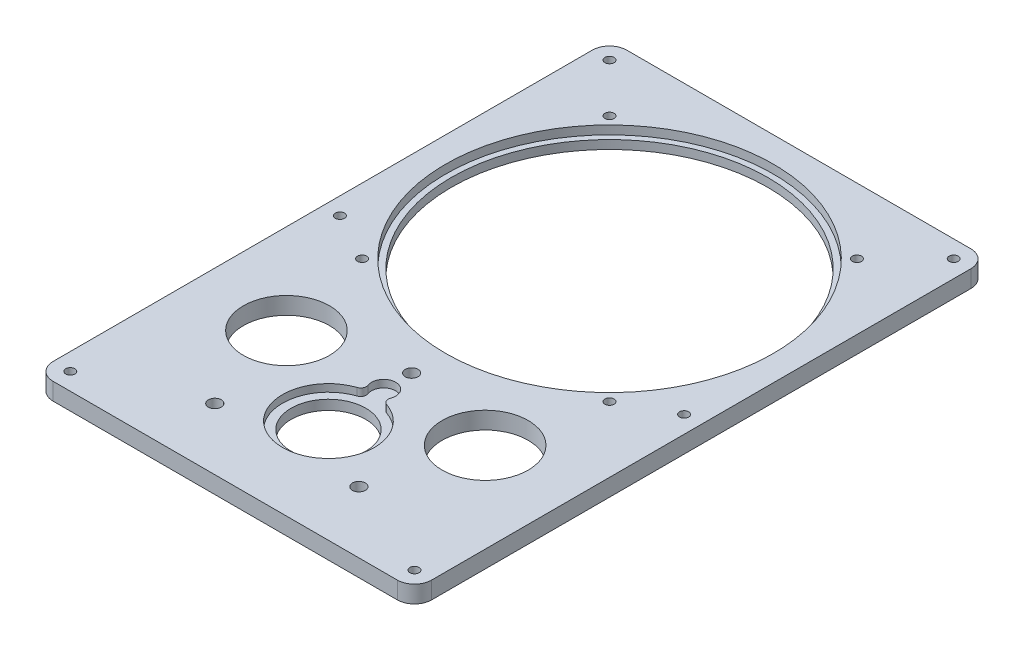
from build123d import *

# Parameters (mm, degrees)
SKETCH_2_W          = 132
SKETCH_2_H          = 200
EXTRUDE_1_DEPTH     = 6
SKETCH_3_R          = 57.15
CUT_EXTRUDE_1_DEPTH = 6
EXTRUDE_START       = 3
SKETCH_6_R          = 57.15
SKETCH_6_R_2        = 55.15
EXTRUDE_2_DEPTH     = 3
SKETCH_10_R         = 1.6
CUT_EXTRUDE_2_DEPTH = 6
SKETCH_11_R         = 13
CUT_EXTRUDE_3_DEPTH = 6
SKETCH_12_R         = 16
CUT_EXTRUDE_4_DEPTH = 2.6
SKETCH_13_R         = 4.2
CUT_EXTRUDE_5_DEPTH = 2.6
FILLET_1_R          = 2
SKETCH_14_R         = 2.25
CUT_EXTRUDE_6_DEPTH = 6
FILLET_2_R          = 6
SKETCH_15_R         = 1.6
CUT_EXTRUDE_7_DEPTH = 6
SKETCH_17_R         = 15
CUT_EXTRUDE_9_DEPTH = 6


with BuildPart() as part:
    # 草图2 → 凸台-拉伸1 (new body)
    with BuildSketch(Plane(origin=(0, 0, 0), x_dir=(1, 0, 0), z_dir=(0, 1, 0))):
        Rectangle(SKETCH_2_W, SKETCH_2_H)
    extrude(amount=EXTRUDE_1_DEPTH)

    # 草图3 → 切除-拉伸1 (cut)
    with BuildSketch(Plane(origin=(0, 6, 0), x_dir=(1, 0, 0), z_dir=(0, 1, 0))):
        with Locations(Location((0, 34, 0), (0, 0, 270))):
            Circle(SKETCH_3_R)
    extrude(amount=-CUT_EXTRUDE_1_DEPTH, mode=Mode.SUBTRACT)

    # 草图6 → 凸台-拉伸2 (add)
    with BuildSketch(Plane(origin=(0, 0, 0), x_dir=(1, 0, 0), z_dir=(0, 1, 0)).offset(EXTRUDE_START)):
        with Locations(Location((0, 34, 0), (0, 0, 270))):
            Circle(SKETCH_6_R)
        with Locations(Location((0, 34, 0), (0, 0, 270))):
            Circle(SKETCH_6_R_2, mode=Mode.SUBTRACT)
    extrude(amount=-EXTRUDE_2_DEPTH)

    # 草图10 → 切除-拉伸2 (cut)
    with BuildSketch(Plane(origin=(0, 6, 0), x_dir=(1, 0, 0), z_dir=(0, 1, 0))):
        with Locations(Location((43.133513652, -9.133513652, 0), (0, 0, 270))):
            Circle(SKETCH_10_R)
        with Locations(Location((-43.133513652, -9.133513652, 0), (0, 0, 270))):
            Circle(SKETCH_10_R)
        with Locations(Location((-43.133513652, 77.133513652, 0), (0, 0, 270))):
            Circle(SKETCH_10_R)
        with Locations(Location((43.133513652, 77.133513652, 0), (0, 0, 270))):
            Circle(SKETCH_10_R)
    extrude(amount=-CUT_EXTRUDE_2_DEPTH, mode=Mode.SUBTRACT)

    # 草图11 → 切除-拉伸3 (cut)
    with BuildSketch(Plane(origin=(0, 6, 0), x_dir=(1, 0, 0), z_dir=(0, 1, 0))):
        with Locations(Location((0, -64, 0), (0, 0, 270))):
            Circle(SKETCH_11_R)
    extrude(amount=-CUT_EXTRUDE_3_DEPTH, mode=Mode.SUBTRACT)

    # 草图12 → 切除-拉伸4 (cut)
    with BuildSketch(Plane(origin=(0, 6, 0), x_dir=(1, 0, 0), z_dir=(0, 1, 0))):
        with Locations(Location((0, -64, 0), (0, 0, 270))):
            Circle(SKETCH_12_R)
    extrude(amount=-CUT_EXTRUDE_4_DEPTH, mode=Mode.SUBTRACT)

    # 草图13 → 切除-拉伸5 (cut)
    with BuildSketch(Plane(origin=(0, 6, 0), x_dir=(1, 0, 0), z_dir=(0, 1, 0))):
        with Locations((0, -44.75)):
            Circle(SKETCH_13_R)
    extrude(amount=-CUT_EXTRUDE_5_DEPTH, mode=Mode.SUBTRACT)

    # 圆角1
    fillet_1_edges = [part.edges().sort_by_distance(p)[0] for p in [
        (2.418429967, 4.7, 48.183831169),
        (-2.418429967, 4.7, 48.183831169),
    ]]
    fillet(fillet_1_edges, radius=FILLET_1_R)

    # 草图14 → 切除-拉伸6 (cut)
    with BuildSketch(Plane(origin=(0, 6, 0), x_dir=(1, 0, 0), z_dir=(0, 1, 0))):
        with Locations(Location((0, -35, 0), (0, 0, 270))):
            Circle(SKETCH_14_R)
        with Locations(Location((25.11473671, -78.5, 0), (0, 0, 270))):
            Circle(SKETCH_14_R)
        with Locations(Location((-25.11473671, -78.5, 0), (0, 0, 270))):
            Circle(SKETCH_14_R)
    extrude(amount=-CUT_EXTRUDE_6_DEPTH, mode=Mode.SUBTRACT)

    # 圆角2
    fillet_2_edges = [part.edges().sort_by_distance(p)[0] for p in [
        (66, 3, 100),
        (-66, 3, 100),
        (-66, 3, -100),
        (66, 3, -100),
    ]]
    fillet(fillet_2_edges, radius=FILLET_2_R)

    # 草图15 → 切除-拉伸7 (cut)
    with BuildSketch(Plane(origin=(0, 6, 0), x_dir=(1, 0, 0), z_dir=(0, 1, 0))):
        with Locations(Location((60, 94, 0), (0, 0, 270))):
            Circle(SKETCH_15_R)
        with Locations(Location((-60, 94, 0), (0, 0, 90))):
            Circle(SKETCH_15_R)
        with Locations(Location((60, -94, 0), (0, 0, 90))):
            Circle(SKETCH_15_R)
        with Locations(Location((-60, -94, 0), (0, 0, 270))):
            Circle(SKETCH_15_R)
        with Locations(Location((60, 0, 0), (0, 0, 270))):
            Circle(SKETCH_15_R)
        with Locations(Location((-60, 0, 0), (0, 0, 90))):
            Circle(SKETCH_15_R)
    extrude(amount=-CUT_EXTRUDE_7_DEPTH, mode=Mode.SUBTRACT)

    # 草图17 → 切除-拉伸9 (cut)
    with BuildSketch(Plane(origin=(0, 6, 0), x_dir=(1, 0, 0), z_dir=(0, 1, 0))):
        with Locations(Location((34.641016151, -44, 0), (0, 0, 270))):
            Circle(SKETCH_17_R)
        with Locations(Location((-34.641016151, -44, 0), (0, 0, 90))):
            Circle(SKETCH_17_R)
    extrude(amount=-CUT_EXTRUDE_9_DEPTH, mode=Mode.SUBTRACT)


solid = part.part
